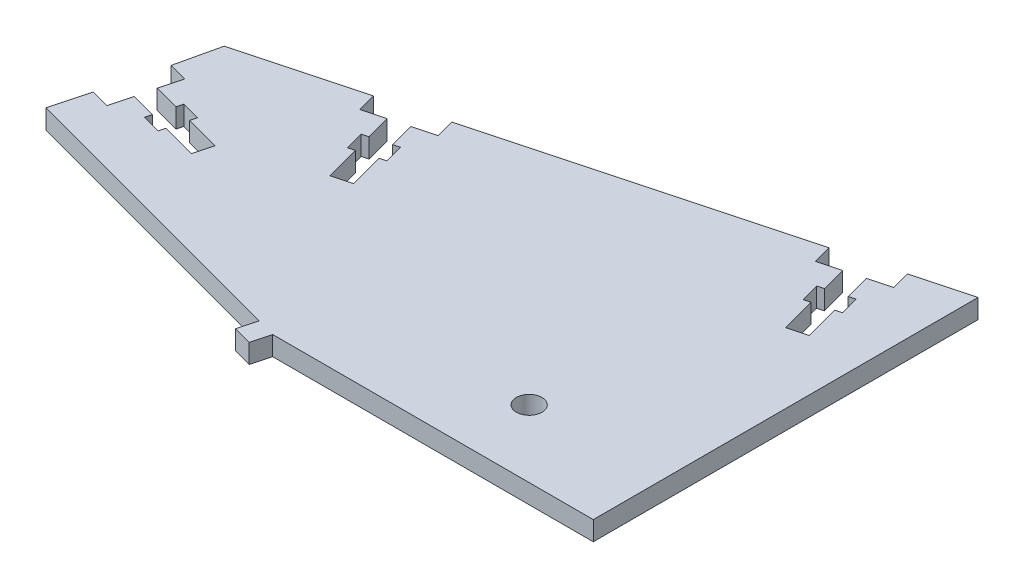
from build123d import *

# Parameters (mm, degrees)
EXTRUDE_1_DEPTH     = 3
SKETCH_2_R          = 2
CUT_EXTRUDE_1_DEPTH = 71.204680691


with BuildPart() as part:
    # 草图1 → 凸台-拉伸1 (new body)
    with BuildSketch(Plane(origin=(0, 0, 0), x_dir=(1, 0, 0), z_dir=(0, 1, 0))):
        Polygon((31.465896135, 36.910648046), (32.24235327, 34.012870567), (28.861612878, 33.107003909), (29.896889059, 29.243300604), (30.862814885, 29.502119649), (31.63927202, 26.604342171), (30.673346194, 26.345523125), (32.122732847, 20.936338498), (29.224955368, 20.159881363), (27.775568715, 25.56906599), (26.809642889, 25.310246945), (26.033185754, 28.208024424), (26.99911158, 28.466843469), (25.9638354, 32.330546774), (22.583095008, 31.424680116), (21.806637872, 34.322457595), (-24.55780179, 21.89914343), (-23.781344654, 19.001365951), (-27.162085046, 18.095499294), (-26.126808866, 14.231795988), (-25.16088304, 14.490615033), (-24.384425904, 11.592837555), (-25.350351731, 11.334018509), (-23.900965078, 5.924833882), (-26.798742557, 5.148376747), (-28.248129209, 10.557561374), (-29.214055036, 10.298742329), (-29.990512171, 13.196519808), (-29.024586345, 13.455338853), (-30.059862525, 17.319042158), (-33.440602917, 16.4131755), (-34.217060053, 19.310952979), (-52.569650752, 14.393391122), (-54.11186912, 7.666843213), (-51.214091641, 6.890386078), (-52.119958299, 3.509645686), (-48.140343895, 2.44331122), (-47.88152485, 3.409237046), (-44.983747371, 2.632779911), (-45.242566416, 1.666854085), (-39.833381789, 0.217467432), (-40.609838924, -2.680310047), (-46.019023551, -1.230923394), (-46.277842596, -2.19684922), (-49.175620075, -1.420392085), (-48.91680103, -0.454466259), (-52.780504335, 0.580809922), (-53.686370993, -2.79993047), (-56.584148472, -2.023473335), (-58.137062743, -7.819028293), (-12.738548907, -19.983523413), (-13.515006042, -22.881300891), (-10.617228564, -23.657758027), (-9.840771428, -20.759980548), (40.159228572, -20.759980548), (40.159228572, 39.240019452), align=None)
    extrude(amount=EXTRUDE_1_DEPTH)

    # 草图2 → 切除-拉伸1 (cut, through all)
    with BuildSketch(Plane(origin=(0, 3, 0), x_dir=(1, 0, 0), z_dir=(0, 1, 0))):
        with Locations(Location((19.659228572, -10.259980548, 0), (0, 0, 270))):
            Circle(SKETCH_2_R)
    extrude(amount=-CUT_EXTRUDE_1_DEPTH, mode=Mode.SUBTRACT)


solid = part.part
